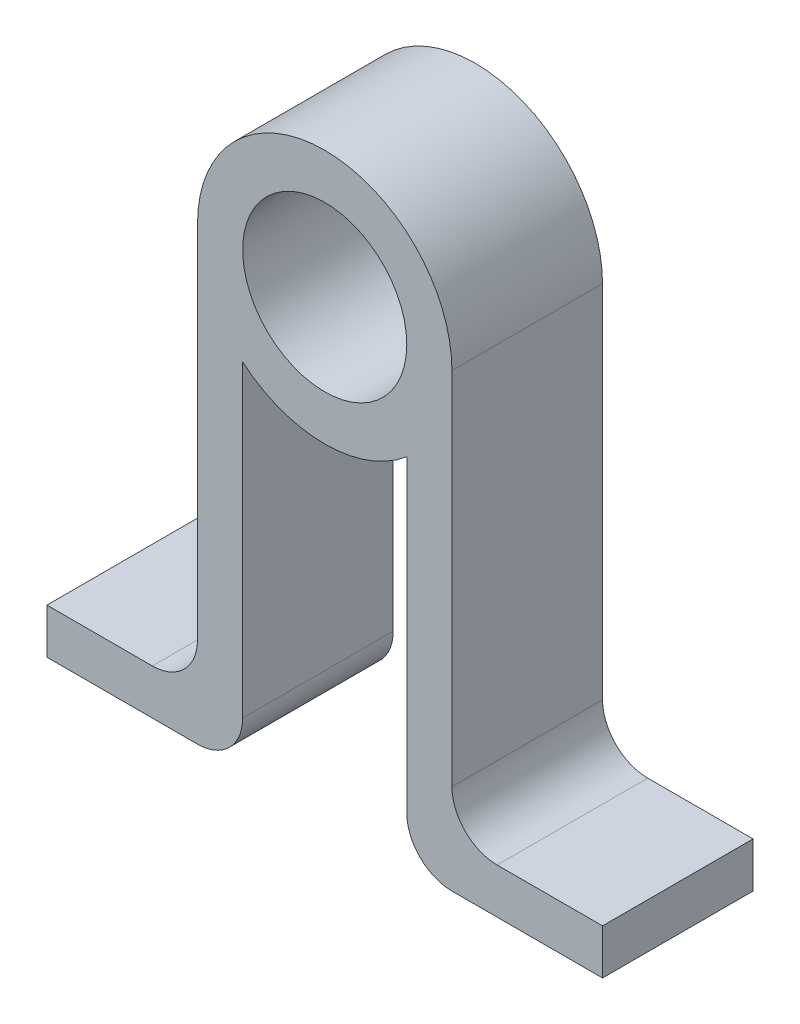
from build123d import *

# Parameters (mm, degrees)
SKETCH1_R           = 5.45
BOSS_EXTRUDE1_DEPTH = 10


with BuildPart() as part:
    # Sketch1 → Boss-Extrude1 (new body)
    with BuildSketch(Plane.XY):
        with BuildLine():
            Line((-5.45, -26.94), (-5.45, -6.457553716))
            ThreePointArc((-5.45, -6.457553716), (0, -8.45), (5.45, -6.457553716))
            Line((5.45, -6.457553716), (5.45, -26.94))
            ThreePointArc((5.45, -26.94), (6.328679656, -29.061320344), (8.45, -29.94))
            Line((8.45, -29.94), (18.45, -29.94))
            Line((18.45, -29.94), (18.45, -26.94))
            Line((18.45, -26.94), (11.45, -26.94))
            ThreePointArc((11.45, -26.94), (9.328679656, -26.061320344), (8.45, -23.94))
            Line((8.45, -23.94), (8.45, 0))
            ThreePointArc((8.45, 0), (0, 8.45), (-8.45, 0))
            Line((-8.45, 0), (-8.45, -23.94))
            ThreePointArc((-8.45, -23.94), (-9.328679656, -26.061320344), (-11.45, -26.94))
            Line((-11.45, -26.94), (-18.45, -26.94))
            Line((-18.45, -26.94), (-18.45, -29.94))
            Line((-18.45, -29.94), (-8.45, -29.94))
            ThreePointArc((-8.45, -29.94), (-6.328679656, -29.061320344), (-5.45, -26.94))
        make_face()
        Circle(SKETCH1_R, mode=Mode.SUBTRACT)
    extrude(amount=BOSS_EXTRUDE1_DEPTH)


solid = part.part
